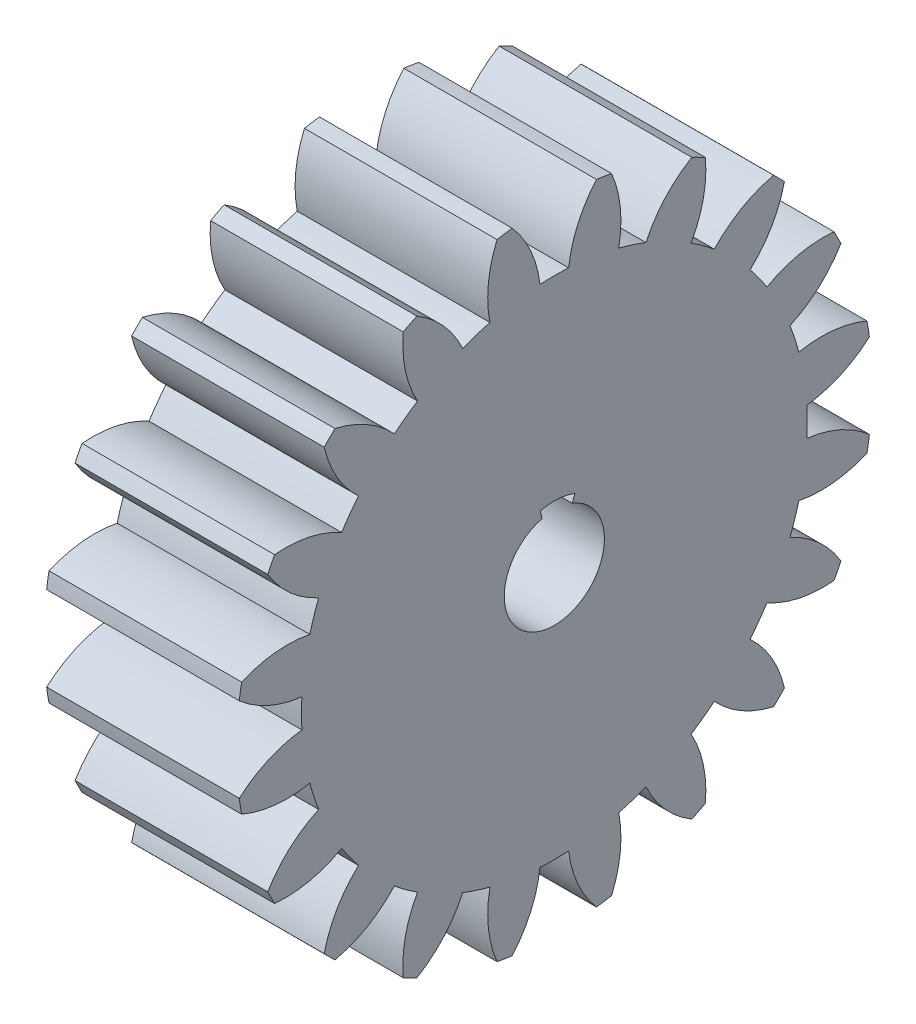
from build123d import *

# Parameters (mm, degrees)
BASPROSKE_W        = 10
BASPROSKE_H        = 16.5
TOOTHCUT_DEPTH     = 26.38700455
TEETHCUTS_COUNT    = 20
TEETHCUTS_ANGLE    = 342
BORSKE_R           = 2.5
BORE_DEPTH         = 50.0000508
CUT_EXTRUDE1_DEPTH = 26.197414545


with BuildPart() as part:
    # BasProSke → Base-Revolve (revolve)
    with BuildSketch(Plane(origin=(0, 0, 0), x_dir=(1, 0, 0), z_dir=(0, 1, 0)), mode=Mode.PRIVATE) as base_revolve_sk:
        with Locations((5, 8.25)):
            Rectangle(BASPROSKE_W, BASPROSKE_H)
    revolve(base_revolve_sk.sketch.rotate(Axis((-10, 0, 0), (1, 0, 0)), 180), axis=Axis((-10, 0, 0), (1, 0, 0)))

    # TooCutSke → ToothCut (cut, through all)
    with BuildSketch(Plane(origin=(0, 0, 0), x_dir=(0, 0, -1), z_dir=(1, 0, 0))):
        with BuildLine():
            ThreePointArc((0.74381438, 13.102904875), (0, 13.124), (-0.74381438, 13.102904875))
            ThreePointArc((-0.74381438, 13.102904875), (-1.226473103, 14.852072512), (-2.209965745, 16.376962373))
            ThreePointArc((-2.209965745, 16.376962373), (0, 16.5254), (2.209965745, 16.376962373))
            ThreePointArc((2.209965745, 16.376962373), (1.226473103, 14.852072512), (0.74381438, 13.102904875))
        make_face()
    toothcut = extrude(amount=TOOTHCUT_DEPTH, mode=Mode.SUBTRACT)

    # TeethCuts: ToothCut ×20 about axis
    teethcuts_axis = Axis((-10, 0, 0), (1, 0, 0))
    for i in range(1, TEETHCUTS_COUNT):
        add(toothcut.rotate(teethcuts_axis, i * TEETHCUTS_ANGLE / (TEETHCUTS_COUNT - 1)), mode=Mode.SUBTRACT)

    # BorSke → Bore (cut, symmetric)
    with BuildSketch(Plane(origin=(0, 0, 0), x_dir=(0, 0, -1), z_dir=(1, 0, 0))):
        with Locations(Location((0, 0, 0), (0, 0, 180))):
            Circle(BORSKE_R)
    extrude(amount=BORE_DEPTH, both=True, mode=Mode.SUBTRACT)

    # Sketch1 → Cut-Extrude1 (cut, through all)
    with BuildSketch(Plane.ZY):
        with BuildLine():
            Line((-1.07128416, 2.802204534), (-0.928446272, 2.428577263))
            ThreePointArc((-0.928446272, 2.428577263), (0.024935516, -2.599880424), (0.881694674, 2.445938368))
            ThreePointArc((0.881694674, 2.445938368), (0.758017697, 2.487048285), (0.63243603, 2.521908933))
            Line((0.63243603, 2.521908933), (0.729733881, 2.909894923))
            ThreePointArc((0.729733881, 2.909894923), (-0.179062708, 2.994651323), (-1.07128416, 2.802204534))
        make_face()
    extrude(amount=-CUT_EXTRUDE1_DEPTH, mode=Mode.SUBTRACT)


solid = part.part
